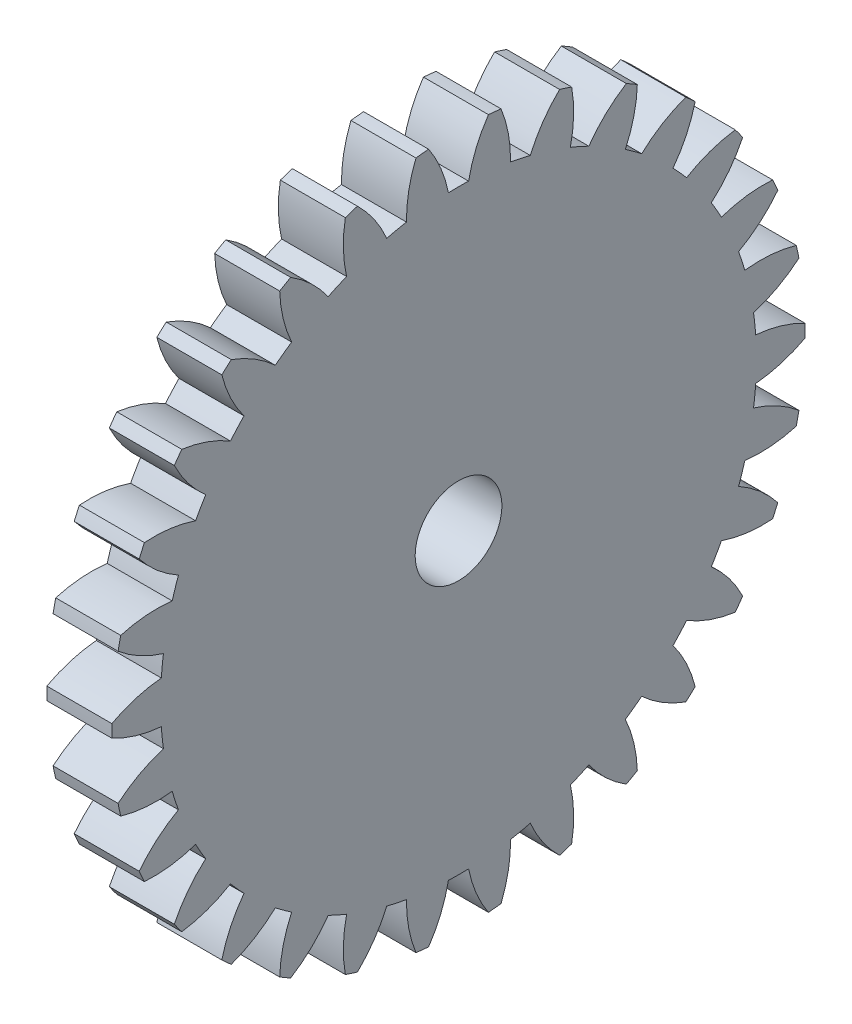
from build123d import *

# Parameters (mm, degrees)
BASPROSKE_W     = 1.5
BASPROSKE_H     = 8
TOOTHCUT_DEPTH  = 12.412712211
TEETHCUTS_COUNT = 30
TEETHCUTS_ANGLE = 348
BORSKE_R        = 1
BORE_DEPTH      = 50.0000508


with BuildPart() as part:
    # BasProSke → Base-Revolve (revolve)
    with BuildSketch(Plane(origin=(0, 0, 0), x_dir=(1, 0, 0), z_dir=(0, 1, 0)), mode=Mode.PRIVATE) as base_revolve_sk:
        with Locations((0.75, 4)):
            Rectangle(BASPROSKE_W, BASPROSKE_H)
    revolve(base_revolve_sk.sketch.rotate(Axis((-10, 0, 0), (1, 0, 0)), 180), axis=Axis((-10, 0, 0), (1, 0, 0)))

    # TooCutSke → ToothCut (cut, through all)
    with BuildSketch(Plane(origin=(0, 0, 0), x_dir=(0, 0, -1), z_dir=(1, 0, 0))):
        with BuildLine():
            ThreePointArc((0.233102578, 6.87004652), (0, 6.874), (-0.233102578, 6.87004652))
            ThreePointArc((-0.233102578, 6.87004652), (-0.41229689, 7.456465027), (-0.706981715, 7.994199273))
            ThreePointArc((-0.706981715, 7.994199273), (0, 8.0254), (0.706981715, 7.994199273))
            ThreePointArc((0.706981715, 7.994199273), (0.41229689, 7.456465027), (0.233102578, 6.87004652))
        make_face()
    toothcut = extrude(amount=TOOTHCUT_DEPTH, mode=Mode.SUBTRACT)

    # TeethCuts: ToothCut ×30 about axis
    teethcuts_axis = Axis((-10, 0, 0), (1, 0, 0))
    for i in range(1, TEETHCUTS_COUNT):
        add(toothcut.rotate(teethcuts_axis, i * TEETHCUTS_ANGLE / (TEETHCUTS_COUNT - 1)), mode=Mode.SUBTRACT)

    # BorSke → Bore (cut, symmetric)
    with BuildSketch(Plane(origin=(0, 0, 0), x_dir=(0, 0, -1), z_dir=(1, 0, 0))):
        with Locations(Location((0, 0, 0), (0, 0, 180))):
            Circle(BORSKE_R)
    extrude(amount=BORE_DEPTH, both=True, mode=Mode.SUBTRACT)


solid = part.part
